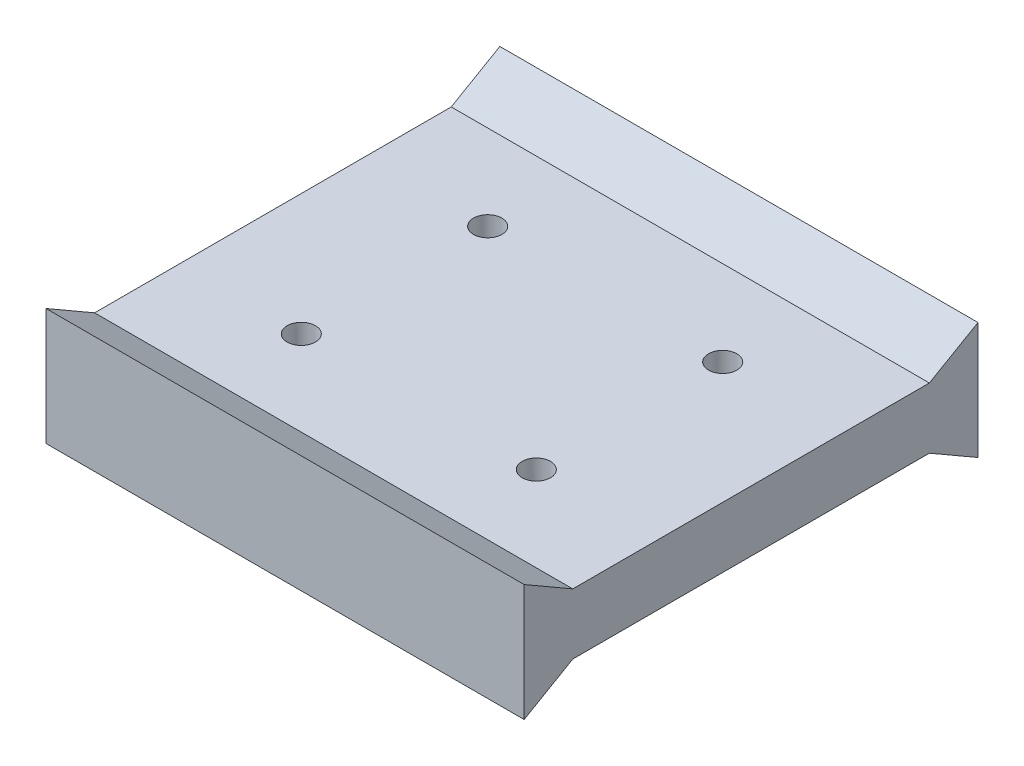
from build123d import *

# Parameters (mm, degrees)
SKETCH1_W           = 59
SKETCH1_H           = 44
SKETCH1_R           = 1.75
BOSS_EXTRUDE1_DEPTH = 7.5
BOSS_EXTRUDE2_DEPTH = 59


with BuildPart() as part:
    # Sketch1 → Boss-Extrude1 (new body)
    with BuildSketch(Plane(origin=(0, 0, 0), x_dir=(1, 0, 0), z_dir=(0, 1, 0))):
        with Locations((29.5, 22)):
            Rectangle(SKETCH1_W, SKETCH1_H)
        with Locations(Location((15, 10.5, 0), (0, 0, 270))):
            Circle(SKETCH1_R, mode=Mode.SUBTRACT)
        with Locations(Location((44, 10.5, 0), (0, 0, 90))):
            Circle(SKETCH1_R, mode=Mode.SUBTRACT)
        with Locations(Location((15, 33.5, 0), (0, 0, 90))):
            Circle(SKETCH1_R, mode=Mode.SUBTRACT)
        with Locations(Location((44, 33.5, 0), (0, 0, 270))):
            Circle(SKETCH1_R, mode=Mode.SUBTRACT)
    extrude(amount=BOSS_EXTRUDE1_DEPTH)

    # Sketch3 → Boss-Extrude2 (add)
    with BuildSketch(Plane(origin=(59, 0, 0), x_dir=(0, 0, -1), z_dir=(1, 0, 0))):
        Polygon((0, 7.5), (-6, 10.964101615), (-6, -3.464101615), (0, 0), align=None)
        Polygon((44, 7.5), (50, 10.964101615), (50, -3.464101615), (44, 0), align=None)
    extrude(amount=-BOSS_EXTRUDE2_DEPTH)


solid = part.part
